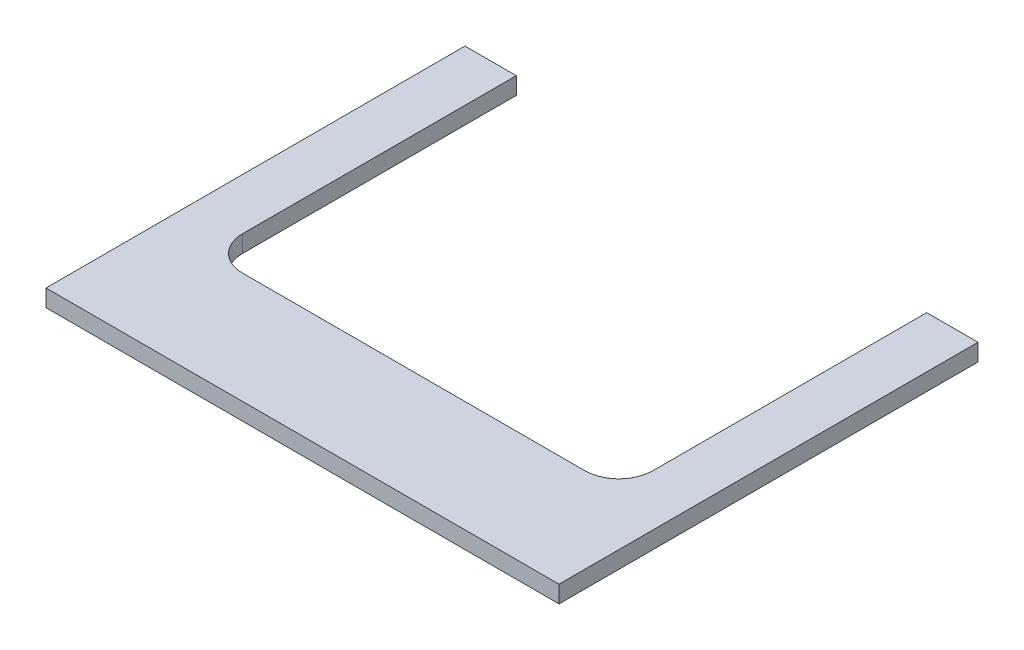
from build123d import *

# Parameters (mm, degrees)
EXTRUDE_1_DEPTH = 10
FILLET_7_R      = 20


with BuildPart() as part:
    # 草图1 → 凸台-拉伸1 (new body)
    with BuildSketch(Plane(origin=(0, 0, 0), x_dir=(1, 0, 0), z_dir=(0, 1, 0))):
        Polygon((-120, 32.5), (120, 32.5), (120, 212.5), (150, 212.5), (150, 32.5), (150, -32.5), (-150, -32.5), (-150, 32.5), (-150, 212.5), (-120, 212.5), align=None)
    extrude(amount=EXTRUDE_1_DEPTH)

    # 圆角7
    fillet_7_edges = [part.edges().sort_by_distance(p)[0] for p in [
        (-120, 5, -32.5),
        (120, 5, -32.5),
    ]]
    fillet(fillet_7_edges, radius=FILLET_7_R)


solid = part.part
